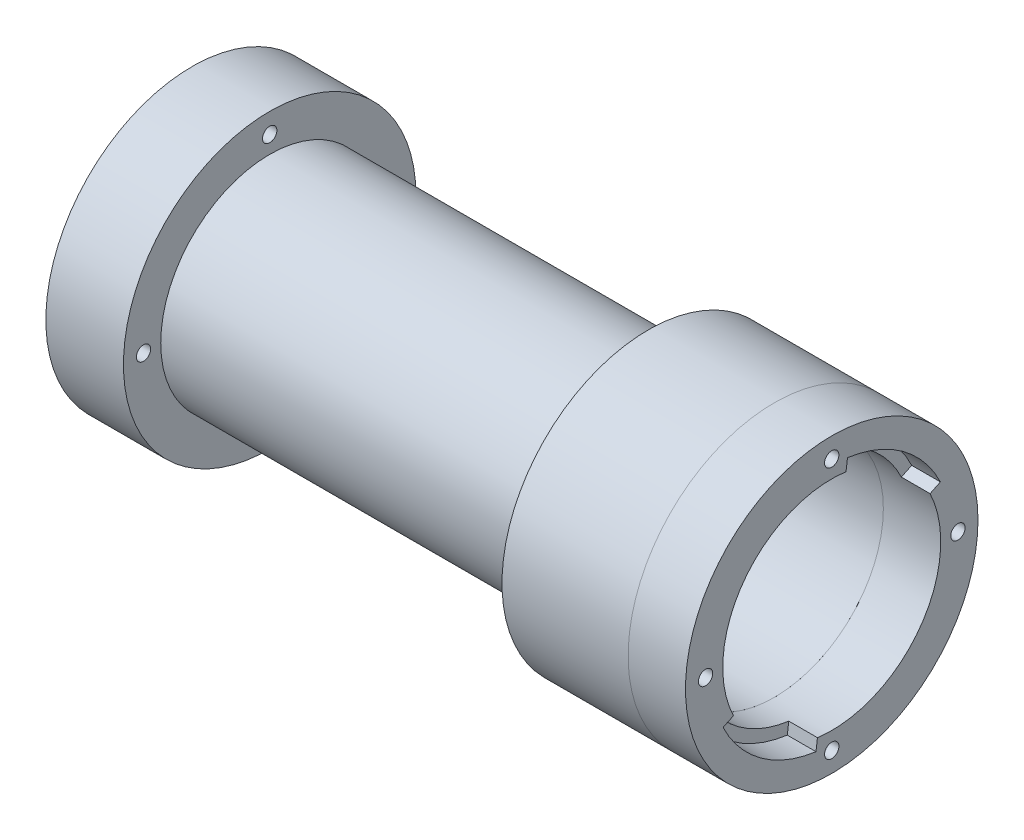
from build123d import *

# Parameters (mm, degrees)
EXTRUDE_1_DEPTH      = 18
EXTRUDE_1_DEPTH_BACK = 9.06
SKETCH_1_R           = 51
SKETCH_1_R_2         = 31
SKETCH_2_R           = 38
SKETCH_2_R_2         = 27
EXTRUDE_2_DEPTH      = 132
SKETCH_3_R           = 51
SKETCH_3_R_2         = 38
EXTRUDE_3_DEPTH      = 63.98
CUT_EXTRUDE_START    = -223.04
SKETCH_4_R           = 2.5
CUT_EXTRUDE_1_DEPTH  = 223.04
CUT_EXTRUDE_START_2  = -10
CUT_EXTRUDE_2_DEPTH  = 10
SKETCH_6_R           = 31
CUT_EXTRUDE_3_DEPTH  = 14


with BuildPart() as part:
    # 草图1 → 凸台-拉伸1 (new, two sides: drawn at the far end of the back side and taken through both)
    with BuildSketch(Plane(origin=(0, 0, 0), x_dir=(0, 0, -1), z_dir=(1, 0, 0)).offset(-EXTRUDE_1_DEPTH_BACK)):
        Circle(SKETCH_1_R)
        Circle(SKETCH_1_R_2, mode=Mode.SUBTRACT)
    extrude(amount=EXTRUDE_1_DEPTH + EXTRUDE_1_DEPTH_BACK)

    # 草图2 → 凸台-拉伸2 (add)
    with BuildSketch(Plane(origin=(18, 0, 0), x_dir=(0, 0, -1), z_dir=(1, 0, 0))):
        Circle(SKETCH_2_R)
        Circle(SKETCH_2_R_2, mode=Mode.SUBTRACT)
    extrude(amount=EXTRUDE_2_DEPTH)


with BuildPart() as body_2:
    # 草图3 → 凸台-拉伸3 (new body)
    with BuildSketch(Plane(origin=(150, 0, 0), x_dir=(0, 0, -1), z_dir=(1, 0, 0))):
        Circle(SKETCH_3_R)
        Circle(SKETCH_3_R_2, mode=Mode.SUBTRACT)
    extrude(amount=EXTRUDE_3_DEPTH)


with BuildPart() as cut_extrude_1_tool:
    # 草图4 → 切除-拉伸1 (new body)
    with BuildSketch(Plane.ZY.offset(9.06).offset(CUT_EXTRUDE_START)):
        with Locations((0, 44)):
            Circle(SKETCH_4_R)
        with Locations((44, 0)):
            Circle(SKETCH_4_R)
        with Locations((0, -44)):
            Circle(SKETCH_4_R)
        with Locations((-44, 0)):
            Circle(SKETCH_4_R)
    extrude(amount=CUT_EXTRUDE_1_DEPTH)


with BuildPart() as part_1:
    add(part.part)

    # 切除-拉伸1: cut by cut_extrude_1_tool
    add(cut_extrude_1_tool.part, mode=Mode.SUBTRACT)

    # 草图6 → 切除-拉伸3 (cut)
    with BuildSketch(Plane(origin=(150, 0, 0), x_dir=(0, 0, -1), z_dir=(1, 0, 0))):
        Circle(SKETCH_6_R)
    extrude(amount=-CUT_EXTRUDE_3_DEPTH, mode=Mode.SUBTRACT)


with BuildPart() as body_2_1:
    add(body_2.part)

    # 切除-拉伸1: cut by cut_extrude_1_tool
    add(cut_extrude_1_tool.part, mode=Mode.SUBTRACT)

    # 草图5 → 切除-拉伸2 (cut)
    with BuildSketch(Plane(origin=(213.98, 0, 0), x_dir=(0, 0, -1), z_dir=(1, 0, 0)).offset(CUT_EXTRUDE_START_2)):
        with BuildLine():
            Line((4.979052634, 37.672390883), (5.503163437, 41.637905713))
            ThreePointArc((5.503163437, 41.637905713), (12.280668917, 40.16447648), (18.723271545, 37.595732506))
            ThreePointArc((18.723271545, 37.595732506), (26.533013809, 32.557628572), (33.043562457, 25.925334717))
            ThreePointArc((33.043562457, 25.925334717), (35.678505016, 22.159518943), (37.886189575, 18.128338023))
            Line((37.886189575, 18.128338023), (34.277981044, 16.40182964))
            ThreePointArc((34.277981044, 16.40182964), (32.280552158, 20.049088568), (29.896556508, 23.45625522))
            ThreePointArc((29.896556508, 23.45625522), (24.006060113, 29.456902041), (16.940102827, 34.015186553))
            ThreePointArc((16.940102827, 34.015186553), (11.111081401, 36.339288244), (4.979052634, 37.672390883))
        make_face()
        with BuildLine():
            Line((-4.979052634, -37.672390883), (-5.503163437, -41.637905713))
            ThreePointArc((-5.503163437, -41.637905713), (-12.280668917, -40.16447648), (-18.723271545, -37.595732506))
            ThreePointArc((-18.723271545, -37.595732506), (-26.533013809, -32.557628572), (-33.043562457, -25.925334717))
            ThreePointArc((-33.043562457, -25.925334717), (-35.678505016, -22.159518943), (-37.886189575, -18.128338023))
            Line((-37.886189575, -18.128338023), (-34.277981044, -16.40182964))
            ThreePointArc((-34.277981044, -16.40182964), (-32.280552158, -20.049088568), (-29.896556508, -23.45625522))
            ThreePointArc((-29.896556508, -23.45625522), (-24.006060113, -29.456902041), (-16.940102827, -34.015186553))
            ThreePointArc((-16.940102827, -34.015186553), (-11.111081401, -36.339288244), (-4.979052634, -37.672390883))
        make_face()
    extrude(amount=CUT_EXTRUDE_2_DEPTH, mode=Mode.SUBTRACT)


with BuildPart() as body_3:
    # Split Bodies 1: the piece on the far side of the plane
    add(body_2_1.part)
    split(bisect_by=Plane(origin=(193.98, 0, 0), x_dir=(0, 0, 1), z_dir=(1, 0, 0)), keep=Keep.BOTTOM)


with BuildPart() as body_2_2:
    add(body_2_1.part)

    # Split Bodies 1
    split(bisect_by=Plane(origin=(193.98, 0, 0), x_dir=(0, 0, 1), z_dir=(1, 0, 0)), keep=Keep.TOP)


solid = Compound([part_1.part, body_3.part, body_2_2.part])
